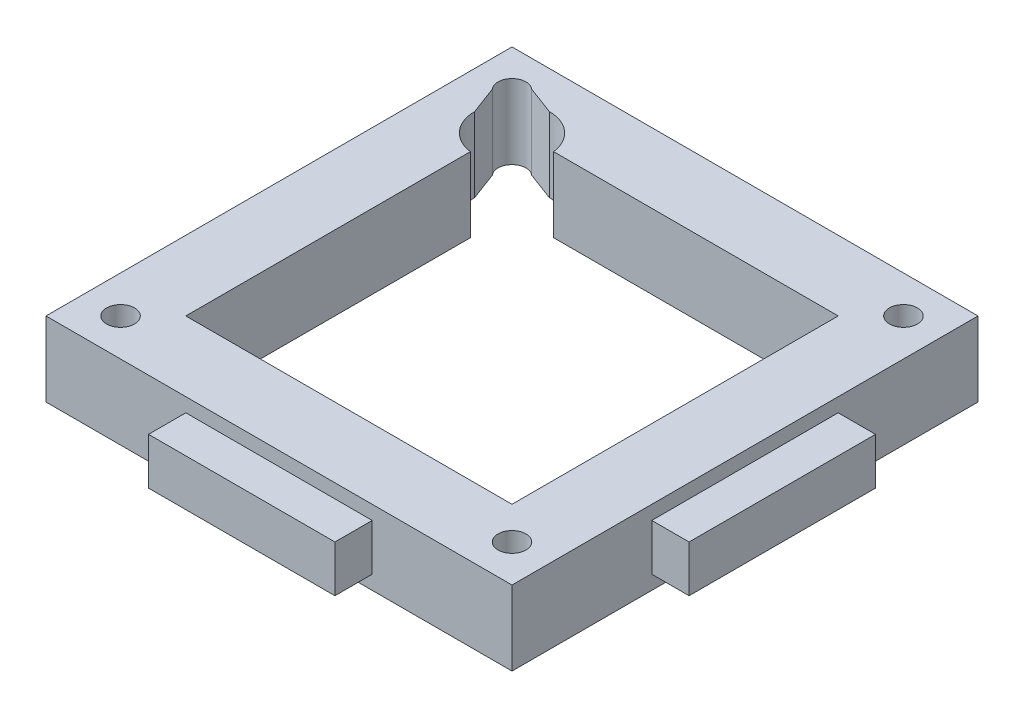
from build123d import *

# Parameters (mm, degrees)
SKETCH1_W         = 50
SKETCH1_H         = 50
SKETCH1_R         = 1.5
SUPPORT_DEPTH     = 8
NORTH_START       = -25
SKETCH2_W         = 20
SKETCH2_H         = 5
NORTH_CUT_DEPTH   = 4
SOUTH_START       = 25
SKETCH2_2_W       = 20
SKETCH2_2_H       = 5
SOUTH_DOWEL_DEPTH = 4
WEST_START        = 25
SKETCH3_W         = 20
SKETCH3_H         = 5
WEST_DOWEL_DEPTH  = 4


with BuildPart() as part:
    # Sketch1 → Support (new body)
    with BuildSketch(Plane(origin=(0, 0, 0), x_dir=(1, 0, 0), z_dir=(0, 1, 0))):
        Rectangle(SKETCH1_W, SKETCH1_H)
        with Locations(Location((-21, -21, 0), (0, 0, 270))):
            Circle(SKETCH1_R, mode=Mode.SUBTRACT)
        with Locations(Location((21, -21, 0), (0, 0, 270))):
            Circle(SKETCH1_R, mode=Mode.SUBTRACT)
        with BuildLine():
            Line((-13.031373033, 17.5), (17.5, 17.5))
            Line((17.5, 17.5), (17.5, -17.5))
            Line((17.5, -17.5), (-17.5, -17.5))
            Line((-17.5, -17.5), (-17.5, 13.031373033))
            ThreePointArc((-17.5, 13.031373033), (-20, 14.354248689), (-21, 17))
            Line((-21, 17), (-22.130136986, 20.01369863))
            ThreePointArc((-22.130136986, 20.01369863), (-22.060660172, 22.060660172), (-20.01369863, 22.130136986))
            Line((-20.01369863, 22.130136986), (-17, 21))
            ThreePointArc((-17, 21), (-14.354248689, 20), (-13.031373033, 17.5))
        make_face(mode=Mode.SUBTRACT)
        with Locations(Location((21, 21, 0), (0, 0, 270))):
            Circle(SKETCH1_R, mode=Mode.SUBTRACT)
    extrude(amount=SUPPORT_DEPTH)

    # Sketch2 → North Cut (cut)
    with BuildSketch(Plane.XY.offset(NORTH_START)):
        with Locations((0, 4)):
            Rectangle(SKETCH2_W, SKETCH2_H)
    extrude(amount=NORTH_CUT_DEPTH, mode=Mode.SUBTRACT)

    # Sketch2<2> → South Dowel (add)
    with BuildSketch(Plane.XY.offset(SOUTH_START)):
        with Locations((0, 4)):
            Rectangle(SKETCH2_2_W, SKETCH2_2_H)
    extrude(amount=SOUTH_DOWEL_DEPTH)

    # Sketch3 → West Dowel (add)
    with BuildSketch(Plane(origin=(0, 0, 0), x_dir=(0, 0, -1), z_dir=(1, 0, 0)).offset(WEST_START)):
        with Locations((0, 4)):
            Rectangle(SKETCH3_W, SKETCH3_H)
    extrude(amount=WEST_DOWEL_DEPTH)


solid = part.part
